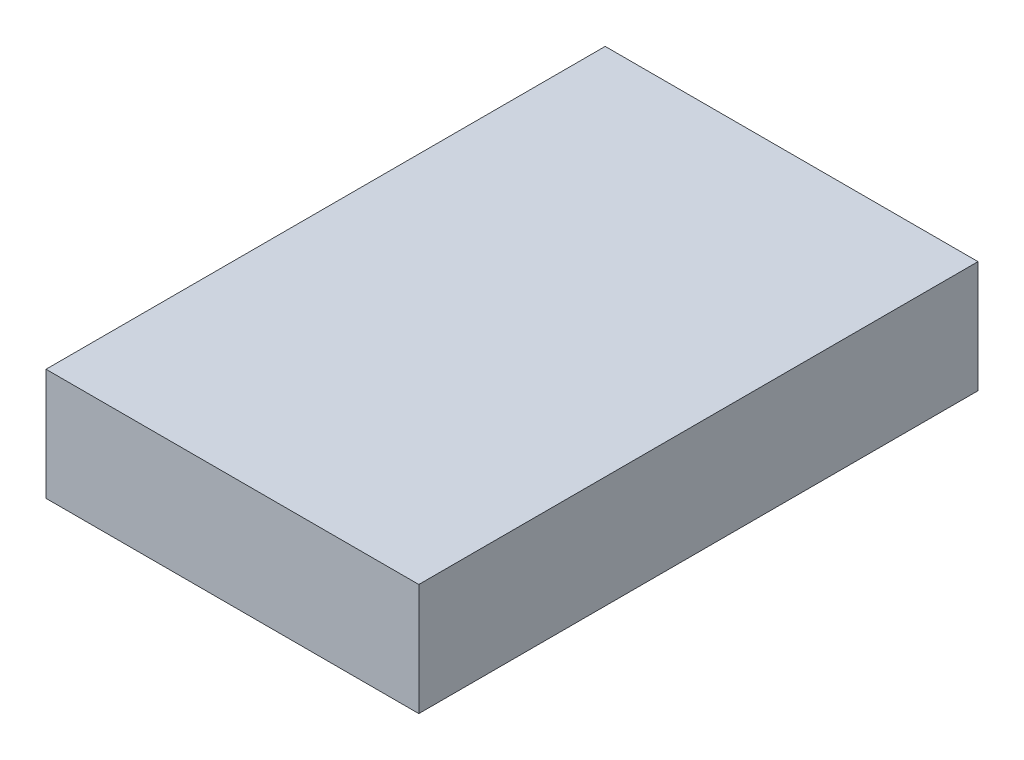
from build123d import *

# Parameters (mm, degrees)
THIN_3_0_001_DEPTH      = 10
THIN_3_0_001_DEPTH_BACK = 5
SKETCH_1_W              = 10
SKETCH_1_H              = 3


with BuildPart() as part:
    # 草图1 → Thin_3_0.001 (new, two sides: drawn at the far end of the back side and taken through both)
    with BuildSketch(Plane.XY.offset(-THIN_3_0_001_DEPTH_BACK)):
        with Locations((0, 0.5)):
            Rectangle(SKETCH_1_W, SKETCH_1_H)
    extrude(amount=THIN_3_0_001_DEPTH + THIN_3_0_001_DEPTH_BACK)


solid = part.part
